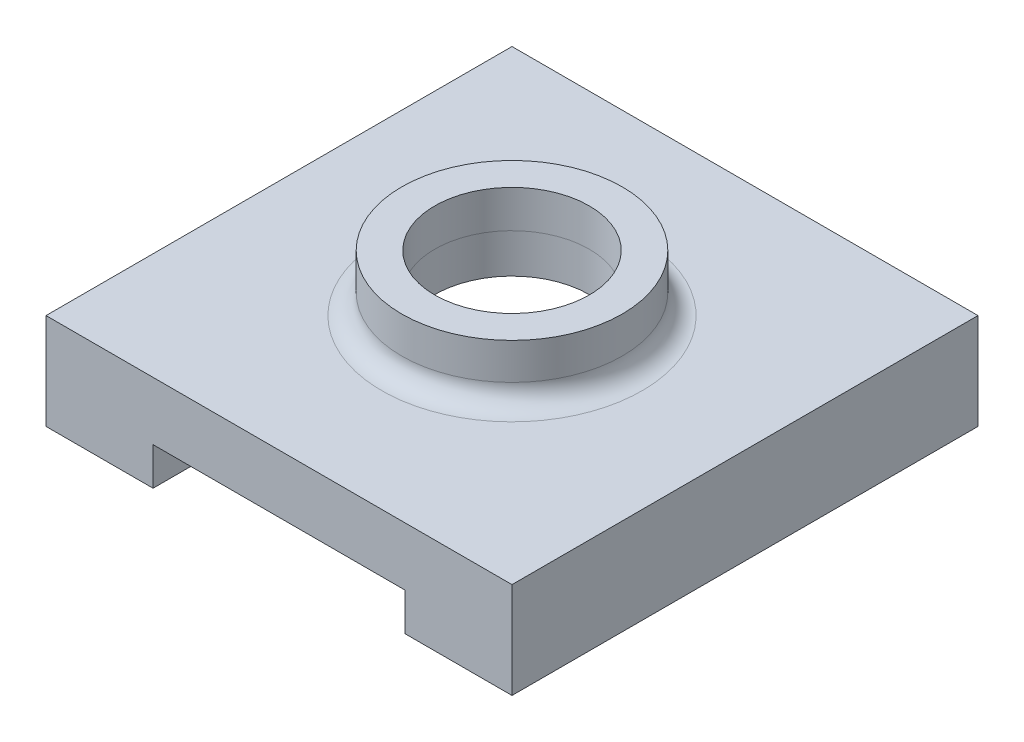
from build123d import *

# Parameters (mm, degrees)
OUTLINE_DEPTH        = 40
OUTLINE_DEPTH_BACK   = 40
SKETCH1_W            = 18.25
SKETCH1_H            = 40
SKETCH2_W            = 40
SKETCH2_H            = 80
EXTRUSION15_DEPTH    = 6
CAMERA_MOUNT_D       = 24.5364
SKETCH5_R            = 17.5
SKETCH5_R_2          = 12.268
EXTRUSION19_DEPTH    = 5.9562
CUT_EXTRUDE1_START   = -3
SKETCH10_W           = 80
SKETCH10_H           = 80
SKETCH10_R           = 17.5
CUT_EXTRUDE1_DEPTH   = 3
SKETCH7_W            = 50
SKETCH7_H            = 50
EXTRUSION22_DEPTH    = 9
FILLET4_R            = 3.175
HOLE7_D              = 3.3
HOLE7_DEPTH          = 12
HOLE7_TIP            = 0.991420021
SKETCH11_OUTSIDE_W   = 105.14
SKETCH11_OUTSIDE_H   = 105.14
SKETCH11_OUTSIDE_W_2 = 74
SKETCH11_OUTSIDE_H_2 = 74
CUT_EXTRUDE2_DEPTH   = 59.588074725
CUT_EXTRUDE3_START   = -3
CUT_EXTRUDE3_DEPTH   = 3


with BuildPart() as part:
    # Sketch1 → Outline (new, two sides: drawn at the far end of the back side and taken through both)
    with BuildSketch(Plane.YZ.offset(-OUTLINE_DEPTH_BACK)):
        Polygon((18.25, 40), (5.33, 40), (0, 40), (0, 0), (18.25, 0), align=None)
        with Locations((9.125, -20)):
            Rectangle(SKETCH1_W, SKETCH1_H)
    extrude(amount=OUTLINE_DEPTH + OUTLINE_DEPTH_BACK)

    # Sketch2 → Extrusion15 (cut)
    with BuildSketch(Plane.XZ):
        Rectangle(SKETCH2_W, SKETCH2_H)
    extrude(amount=-EXTRUSION15_DEPTH, mode=Mode.SUBTRACT)

    # Camera mount (through all)
    with Locations(Plane(origin=(0, 18.25, 0), x_dir=(1, 0, 0), z_dir=(0, 1, 0))):
        with Locations((0, 0)):
            Hole(CAMERA_MOUNT_D / 2)

    # Sketch5 → Extrusion19 (add)
    with BuildSketch(Plane(origin=(0, 18.25, 0), x_dir=(-1, 0, 0), z_dir=(0, 1, 0))):
        with Locations(Location((0, 0, 0), (0, 0, 90))):
            Circle(SKETCH5_R)
        with Locations(Location((0, 0, 0), (0, 0, 90))):
            Circle(SKETCH5_R_2, mode=Mode.SUBTRACT)
    extrude(amount=EXTRUSION19_DEPTH)

    # Sketch10 → Cut-Extrude1 (cut)
    with BuildSketch(Plane(origin=(0, 18.25, 0), x_dir=(1, 0, 0), z_dir=(0, 1, 0)).offset(CUT_EXTRUDE1_START)):
        Rectangle(SKETCH10_W, SKETCH10_H)
        with Locations(Location((0, 0, 0), (0, 0, 270))):
            Circle(SKETCH10_R, mode=Mode.SUBTRACT)
    extrude(amount=CUT_EXTRUDE1_DEPTH, mode=Mode.SUBTRACT)

    # Sketch7 → Extrusion22 (cut)
    with BuildSketch(Plane.XZ):
        Rectangle(SKETCH7_W, SKETCH7_H)
    extrude(amount=-EXTRUSION22_DEPTH, mode=Mode.SUBTRACT)

    # Fillet4
    fillet4_edges = [part.edges().sort_by_distance(p)[0] for p in [
        (0, 15.25, -17.5),
        (-25, 4.5, 25),
        (25, 4.5, -25),
        (-25, 4.5, -25),
        (25, 4.5, 25),
    ]]
    fillet(fillet4_edges, radius=FILLET4_R)

    # Hole7
    with Locations(Plane(origin=(0, 0, 0), x_dir=(-1, 0, 0), z_dir=(0, -1, 0))):
        with Locations((30, 27.5), (-30, 27.5), (-30, -27.5), (30, -27.5)):
            Hole(HOLE7_D / 2, depth=HOLE7_DEPTH)
            with Locations((0, 0, -(HOLE7_DEPTH + HOLE7_TIP / 2))):  # 118° drill point
                Cone(0, HOLE7_D / 2, HOLE7_TIP, mode=Mode.SUBTRACT)

    # Sketch11 outside → Cut-Extrude2 (cut, through all)
    with BuildSketch(Plane(origin=(0, 15.25, 0), x_dir=(1, 0, 0), z_dir=(0, 1, 0))):
        Rectangle(SKETCH11_OUTSIDE_W, SKETCH11_OUTSIDE_H)
        Rectangle(SKETCH11_OUTSIDE_W_2, SKETCH11_OUTSIDE_H_2, mode=Mode.SUBTRACT)
    extrude(amount=-CUT_EXTRUDE2_DEPTH, mode=Mode.SUBTRACT)

    # Sketch13 → Cut-Extrude3 (cut)
    with BuildSketch(Plane.XZ.offset(-9).offset(CUT_EXTRUDE3_START)):
        with BuildLine():
            Line((21.825, 25), (-21.825, 25))
            ThreePointArc((-21.825, 25), (-24.07006403, 24.07006403), (-25, 21.825))
            Line((-25, 21.825), (-25, -21.825))
            ThreePointArc((-25, -21.825), (-24.07006403, -24.07006403), (-21.825, -25))
            Line((-21.825, -25), (21.825, -25))
            ThreePointArc((21.825, -25), (24.07006403, -24.07006403), (25, -21.825))
            Line((25, -21.825), (25, 21.825))
            ThreePointArc((25, 21.825), (24.07006403, 24.07006403), (21.825, 25))
        make_face()
    extrude(amount=CUT_EXTRUDE3_DEPTH, mode=Mode.SUBTRACT)


solid = part.part
